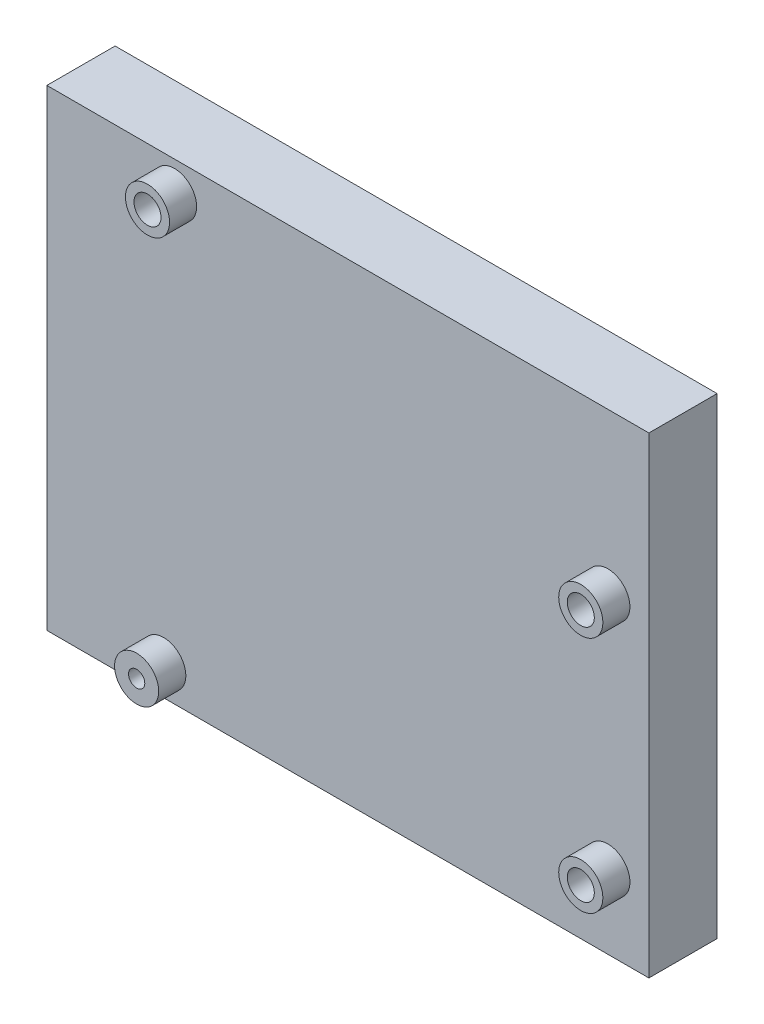
from build123d import *

# Parameters (mm, degrees)
SKETCH1_W           = 70.58
SKETCH1_H           = 55.34
SKETCH1_R           = 1.5875
BOSS_EXTRUDE1_DEPTH = 4
SKETCH2_R           = 2.5
CUT_EXTRUDE1_DEPTH  = 6
SKETCH3_R           = 2.5875
SKETCH3_R_2         = 1.5875
SKETCH3_R_3         = 0.9525
BOSS_EXTRUDE2_DEPTH = 3.175


with BuildPart() as part:
    # Sketch1 → Boss-Extrude1 (new, symmetric)
    with BuildSketch(Plane.XY):
        Rectangle(SKETCH1_W, SKETCH1_H)
        with Locations((-20.32, 24.13)):
            Circle(SKETCH1_R, mode=Mode.SUBTRACT)
        with Locations((30.48, 8.89)):
            Circle(SKETCH1_R, mode=Mode.SUBTRACT)
        with Locations((30.48, -19.05)):
            Circle(SKETCH1_R, mode=Mode.SUBTRACT)
        with Locations((-21.59, -24.13)):
            Circle(SKETCH1_R, mode=Mode.SUBTRACT)
    extrude(amount=BOSS_EXTRUDE1_DEPTH, both=True)

    # Sketch2 → Cut-Extrude1 (cut)
    with BuildSketch(Plane(origin=(0, -27.67, 0), x_dir=(1, 0, 0), z_dir=(0, 1, 0))):
        with Locations(Location((30, 0, 0), (0, 0, 270))):
            Circle(SKETCH2_R)
        with Locations(Location((-30, 0, 0), (0, 0, 90))):
            Circle(SKETCH2_R)
    extrude(amount=CUT_EXTRUDE1_DEPTH, mode=Mode.SUBTRACT)

    # Sketch3 → Boss-Extrude2 (add)
    # profile 1 of 4: a face of its own
    with BuildSketch(Plane.XY.offset(4)):
        with Locations(Location((-20.32, 24.13, 0), (0, 0, 180))):
            Circle(SKETCH3_R)
        with Locations((-20.32, 24.13)):
            Circle(SKETCH3_R_2, mode=Mode.SUBTRACT)
    # profile 2 of 4: a face of its own
    with BuildSketch(Plane.XY.offset(4)):
        with Locations(Location((-21.59, -24.13, 0), (0, 0, 180))):
            Circle(SKETCH3_R)
        with Locations((-21.59, -24.13)):
            Circle(SKETCH3_R_3, mode=Mode.SUBTRACT)
    # profile 3 of 4: a face of its own
    with BuildSketch(Plane.XY.offset(4)):
        with Locations(Location((30.48, 8.89, 0), (0, 0, 180))):
            Circle(SKETCH3_R)
        with Locations((30.48, 8.89)):
            Circle(SKETCH3_R_2, mode=Mode.SUBTRACT)
    # profile 4 of 4: a face of its own
    with BuildSketch(Plane.XY.offset(4)):
        with Locations(Location((30.48, -19.05, 0), (0, 0, 180))):
            Circle(SKETCH3_R)
        with Locations((30.48, -19.05)):
            Circle(SKETCH3_R_2, mode=Mode.SUBTRACT)
    extrude(amount=BOSS_EXTRUDE2_DEPTH)


solid = part.part
